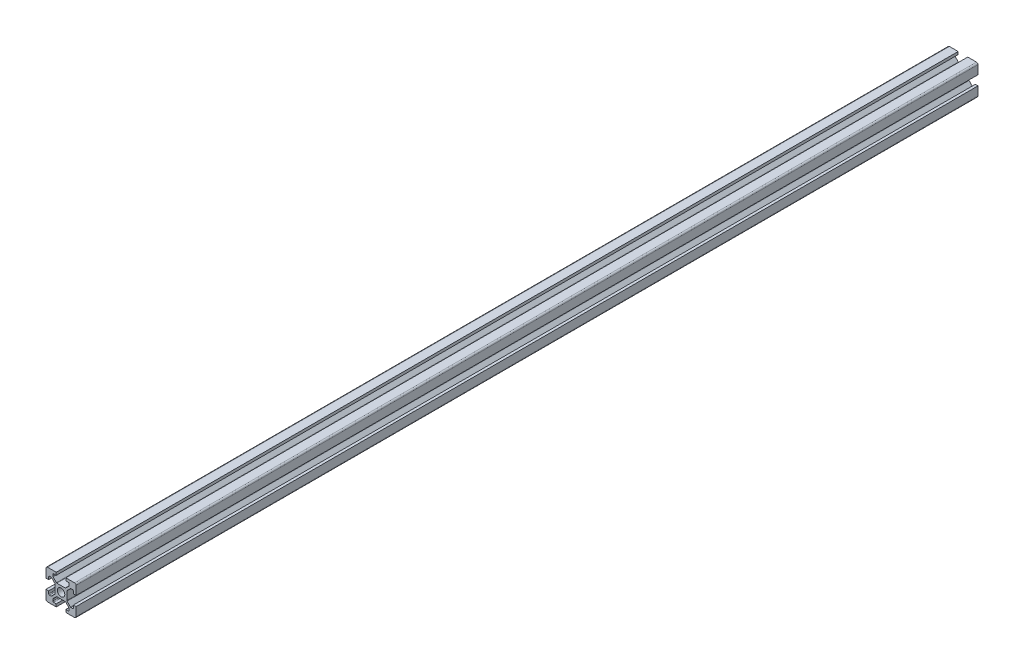
from build123d import *

# Parameters (mm, degrees)
SKETCH1_R           = 2.5
BOSS_EXTRUDE1_DEPTH = 600
FILLET1_R           = 1
FILLET2_R           = 0.5
FILLET3_R           = 0.5
FILLET4_R           = 0.5
FILLET5_R           = 0.5


with BuildPart() as part:
    # Sketch1 → Boss-Extrude1 (new body)
    with BuildSketch(Plane.XY):
        Polygon((13.2, 0), (13.2, 1.8), (15.45, 1.8), (15.45, 3.6), (12.95, 6.1), (7.05, 6.1), (4.55, 3.6), (4.55, 1.8), (6.8, 1.8), (6.8, 0), (0, 0), (0, 6.8), (1.8, 6.8), (1.8, 4.55), (3.6, 4.55), (6.1, 7.05), (6.1, 12.95), (3.6, 15.45), (1.8, 15.45), (1.8, 13.2), (0, 13.2), (0, 20), (6.8, 20), (6.8, 18.2), (4.55, 18.2), (4.55, 16.4), (7.05, 13.9), (12.95, 13.9), (15.45, 16.4), (15.45, 18.2), (13.2, 18.2), (13.2, 20), (20, 20), (20, 13.2), (18.2, 13.2), (18.2, 15.45), (16.4, 15.45), (13.9, 12.95), (13.9, 7.05), (16.4, 4.55), (18.2, 4.55), (18.2, 6.8), (20, 6.8), (20, 0), align=None)
        with Locations((10, 10)):
            Circle(SKETCH1_R, mode=Mode.SUBTRACT)
    extrude(amount=BOSS_EXTRUDE1_DEPTH)

    # Fillet1
    fillet1_edges = [part.edges().sort_by_distance(p)[0] for p in [
        (0, 0, 300),
        (0, 20, 300),
        (20, 20, 300),
        (20, 0, 300),
    ]]
    fillet(fillet1_edges, radius=FILLET1_R)

    # Fillet2
    fillet2_edges = [part.edges().sort_by_distance(p)[0] for p in [
        (4.55, 18.2, 300),
        (4.55, 16.4, 300),
        (7.05, 13.9, 300),
        (12.95, 13.9, 300),
        (15.45, 16.4, 300),
        (15.45, 18.2, 300),
    ]]
    fillet(fillet2_edges, radius=FILLET2_R)

    # Fillet3
    fillet3_edges = [part.edges().sort_by_distance(p)[0] for p in [
        (18.2, 15.45, 300),
        (16.4, 15.45, 300),
        (13.9, 12.95, 300),
        (13.9, 7.05, 300),
        (16.4, 4.55, 300),
        (18.2, 4.55, 300),
    ]]
    fillet(fillet3_edges, radius=FILLET3_R)

    # Fillet4
    fillet4_edges = [part.edges().sort_by_distance(p)[0] for p in [
        (1.8, 4.55, 300),
        (3.6, 4.55, 300),
        (6.1, 7.05, 300),
        (6.1, 12.95, 300),
        (3.6, 15.45, 300),
        (1.8, 15.45, 300),
    ]]
    fillet(fillet4_edges, radius=FILLET4_R)

    # Fillet5
    fillet5_edges = [part.edges().sort_by_distance(p)[0] for p in [
        (15.45, 1.8, 300),
        (15.45, 3.6, 300),
        (12.95, 6.1, 300),
        (7.05, 6.1, 300),
        (4.55, 3.6, 300),
        (4.55, 1.8, 300),
    ]]
    fillet(fillet5_edges, radius=FILLET5_R)


solid = part.part
